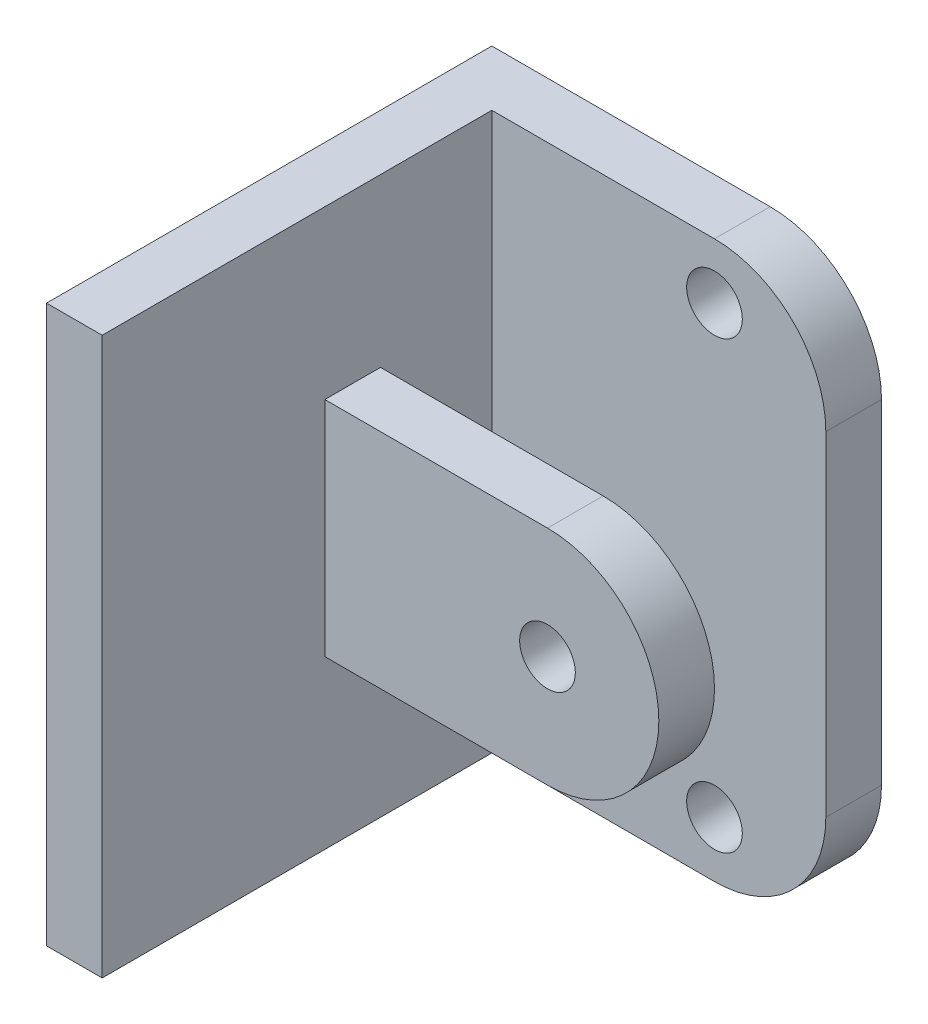
from build123d import *

# Parameters (mm, degrees)
SKETCH1_R           = 2.5
BOSS_EXTRUDE1_DEPTH = 5
CUT_EXTRUDE1_DEPTH  = 5
SKETCH3_W           = 40
SKETCH3_H           = 50
BOSS_EXTRUDE2_DEPTH = 5
SKETCH4_W           = 5
SKETCH4_H           = 50
BOSS_EXTRUDE3_DEPTH = 30
SKETCH5_R           = 2.5
CUT_EXTRUDE2_DEPTH  = 20
FILLET1_R           = 10
FILLET2_R           = 10


with BuildPart() as part:
    # Sketch1 → Boss-Extrude1 (new body)
    with BuildSketch(Plane.XY):
        Polygon((-5.063803349, -1.952454159), (-5.063803349, 8.047545841), (-5.063803349, 18.047545841), (-35.063803349, 18.047545841), (-35.063803349, -1.952454159), align=None)
        with Locations((-15.063803349, 8.047545841)):
            Circle(SKETCH1_R, mode=Mode.SUBTRACT)
    extrude(amount=BOSS_EXTRUDE1_DEPTH)

    # Sketch2 → Cut-Extrude1 (cut)
    with BuildSketch(Plane.XY.offset(5)):
        with BuildLine():
            ThreePointArc((-15.063803349, 18.047545841), (-7.992735537, 15.118613653), (-5.063803349, 8.047545841))
            Line((-5.063803349, 8.047545841), (-5.063803349, 18.047545841))
            Line((-5.063803349, 18.047545841), (-15.063803349, 18.047545841))
        make_face()
        with BuildLine():
            Line((-5.063803349, -1.952454159), (-5.063803349, 8.047545841))
            ThreePointArc((-5.063803349, 8.047545841), (-7.992735537, 0.976478029), (-15.063803349, -1.952454159))
            Line((-15.063803349, -1.952454159), (-5.063803349, -1.952454159))
        make_face()
    extrude(amount=-CUT_EXTRUDE1_DEPTH, mode=Mode.SUBTRACT)

    # Sketch3 → Boss-Extrude2 (add)
    with BuildSketch(Plane.ZY.offset(35.063803349)):
        with Locations((5, 8.047545841)):
            Rectangle(SKETCH3_W, SKETCH3_H)
    extrude(amount=BOSS_EXTRUDE2_DEPTH)

    # Sketch4 → Boss-Extrude3 (add)
    with BuildSketch(Plane(origin=(-35.063803349, 0, 0), x_dir=(0, 0, -1), z_dir=(1, 0, 0))):
        with Locations((12.5, 8.047545841)):
            Rectangle(SKETCH4_W, SKETCH4_H)
    extrude(amount=BOSS_EXTRUDE3_DEPTH)

    # Sketch5 → Cut-Extrude2 (cut)
    with BuildSketch(Plane.XY.offset(-10)):
        with Locations((-15.063803349, 28.047545841)):
            Circle(SKETCH5_R)
        with Locations((-15.063803349, -11.952454159)):
            Circle(SKETCH5_R)
    extrude(amount=-CUT_EXTRUDE2_DEPTH, mode=Mode.SUBTRACT)

    # Fillet1
    fillet1_edges = [part.edges().sort_by_distance(p)[0] for p in [
        (-5.063803349, 33.047545841, -12.5),
    ]]
    fillet(fillet1_edges, radius=FILLET1_R)

    # Fillet2
    fillet2_edges = [part.edges().sort_by_distance(p)[0] for p in [
        (-5.063803349, -16.952454159, -12.5),
    ]]
    fillet(fillet2_edges, radius=FILLET2_R)


solid = part.part
